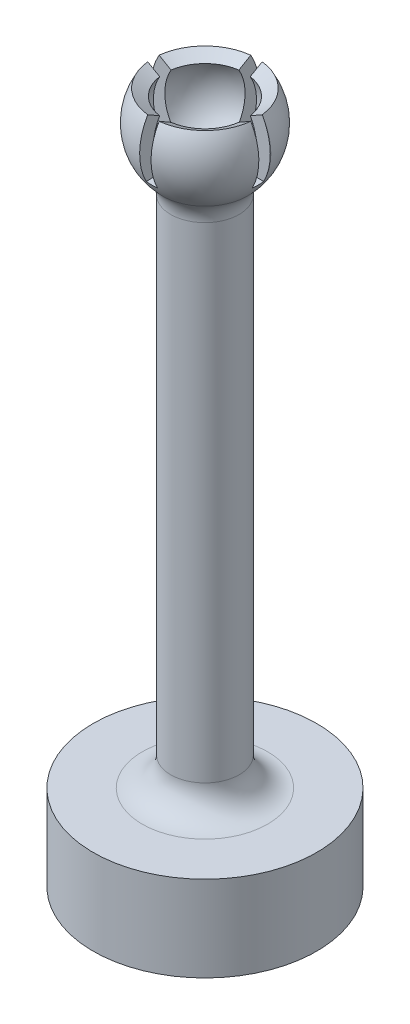
from build123d import *

# Parameters (mm, degrees)
FILLET1_R          = 2.5
SKETCH3_W          = 0.5
SKETCH3_H          = 9.3
CUT_EXTRUDE1_DEPTH = 5
SCALE1_SCALE       = 1.3


with BuildPart() as part:
    # Sketch1 → Revolve1 (revolve)
    with BuildSketch(Plane.XY, mode=Mode.PRIVATE) as revolve1_sk:
        with BuildLine():
            Line((0, 53.95), (0, 50))
            Line((0, 50), (3, 50))
            Line((3, 50), (3, 53.691578015))
            ThreePointArc((3, 53.691578015), (5.124061271, 56.856979401), (4.54663337, 60.625))
            Line((4.54663337, 60.625), (3.507402885, 60.025))
            ThreePointArc((3.507402885, 60.025), (3.507402885, 55.975), (0, 53.95))
        make_face()
        Polygon((0, 50), (0, 0), (9.8, 0), (9.8, 7.5), (3, 7.5), (3, 50), align=None)
    revolve(revolve1_sk.sketch.rotate(Axis((0, 58, 0), (0, -1, 0)), 180), axis=Axis((0, 58, 0), (0, -1, 0)))

    # Fillet1
    fillet1_edges = [part.edges().sort_by_distance(p)[0] for p in [
        (3, 53.691578015, 0),
        (3, 7.5, 0),
    ]]
    fillet(fillet1_edges, radius=FILLET1_R)

    # Sketch3 → Cut-Extrude1 (cut)
    with BuildSketch(Plane(origin=(0, 60.625, 0), x_dir=(1, 0, 0), z_dir=(0, 1, 0))):
        Polygon((0.5, 0), (0.5, -0.5), (9.8, -0.5), (9.8, 0.5), (0.5, 0.5), align=None)
        Polygon((-0.5, 9.8), (-0.5, 0.5), (0, 0.5), (0.5, 0.5), (0.5, 9.8), align=None)
        Polygon((-9.8, -0.5), (-0.5, -0.5), (-0.5, 0), (-0.5, 0.5), (-9.8, 0.5), align=None)
        with Locations((0.25, -5.15)):
            Rectangle(SKETCH3_W, SKETCH3_H)
        with Locations((-0.25, -5.15)):
            Rectangle(SKETCH3_W, SKETCH3_H)
    extrude(amount=-CUT_EXTRUDE1_DEPTH, mode=Mode.SUBTRACT)


with BuildPart() as part_1:
    # Scale1: scaled about (0, 0, 0)
    add(part.part.scale(SCALE1_SCALE))


solid = part_1.part
